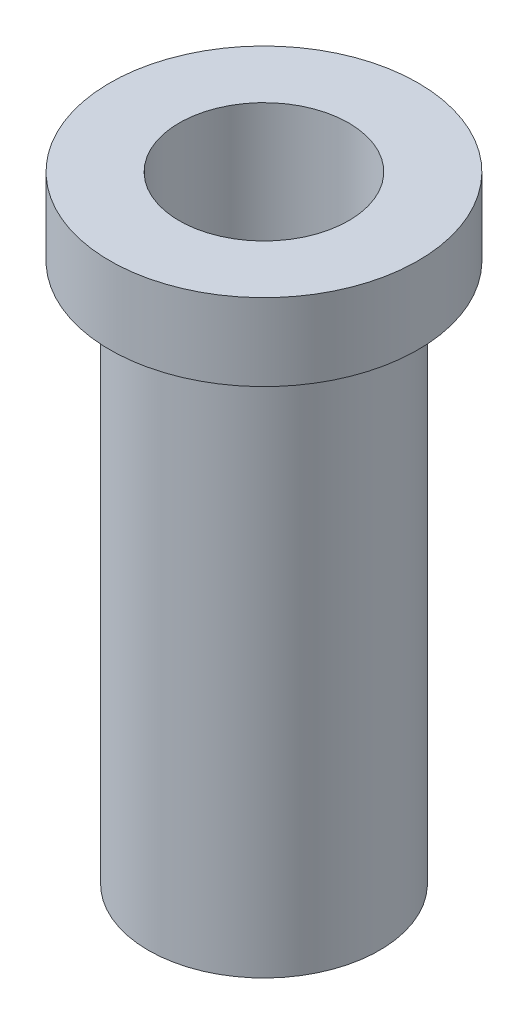
from build123d import *


with BuildPart() as part:
    # Sketch2 → Revolve1 (revolve)
    with BuildSketch(Plane.XY, mode=Mode.PRIVATE) as revolve1_sk:
        Polygon((5.5, 0), (5.5, 40), (10, 40), (10, 35), (7.5, 35), (7.5, 0), align=None)
    revolve(revolve1_sk.sketch.rotate(Axis((0, 0, 0), (0, 1, 0)), 90), axis=Axis((0, 0, 0), (0, 1, 0)))


solid = part.part
